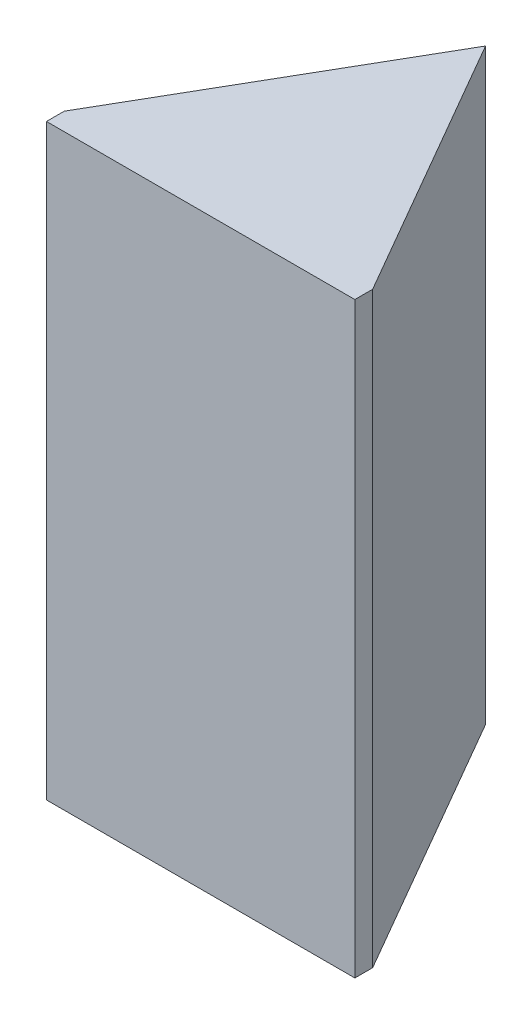
from build123d import *

# Parameters (mm, degrees)
BOSS_EXTRUDE1_DEPTH = 33


with BuildPart() as part:
    # Sketch1 → Boss-Extrude1 (new, symmetric)
    with BuildSketch(Plane(origin=(0, 0, 0), x_dir=(1, 0, 0), z_dir=(0, 1, 0))):
        Polygon((34.641016151, 0), (17.320508076, 30), (0, 0), (0, -2), (34.641016151, -2), align=None)
    extrude(amount=BOSS_EXTRUDE1_DEPTH, both=True)


solid = part.part
